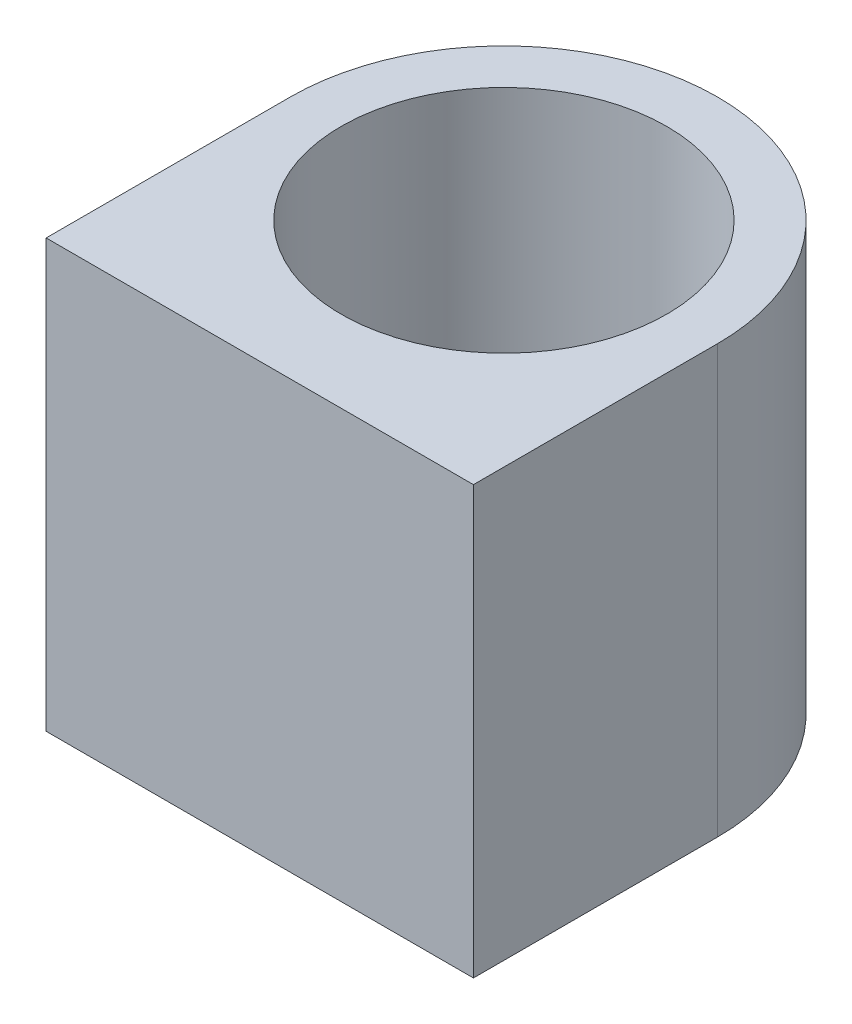
from build123d import *

# Parameters (mm, degrees)
SKETCH1_R           = 8
BOSS_EXTRUDE1_DEPTH = 21


with BuildPart() as part:
    # Sketch1 → Boss-Extrude1 (new body)
    with BuildSketch(Plane(origin=(0, 0, 0), x_dir=(1, 0, 0), z_dir=(0, 1, 0))):
        with BuildLine():
            Line((-10.5, 0), (-10.5, -12))
            Line((-10.5, -12), (10.5, -12))
            Line((10.5, -12), (10.5, 0))
            ThreePointArc((10.5, 0), (0, 10.5), (-10.5, 0))
        make_face()
        with Locations(Location((0, 0, 0), (0, 0, 90))):
            Circle(SKETCH1_R, mode=Mode.SUBTRACT)
    extrude(amount=BOSS_EXTRUDE1_DEPTH)


solid = part.part
